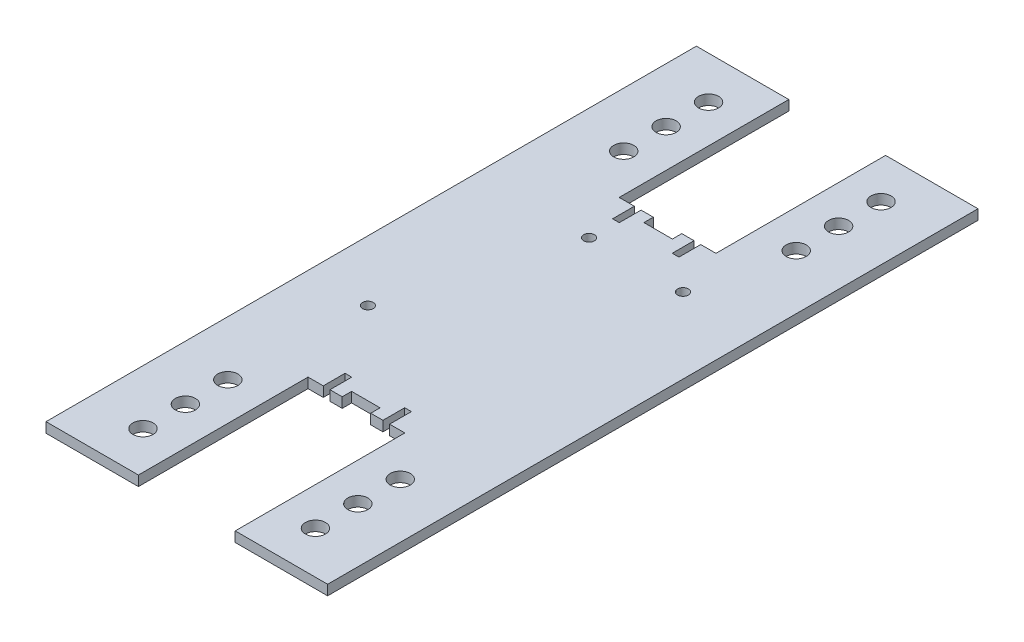
from build123d import *

# Parameters (mm, degrees)
ESBO_O1_W                = 84
ESBO_O1_H                = 3
RESSALTO_EXTRUS_O1_DEPTH = 194
CORTE_EXTRUS_O1_DEPTH    = 194
CORTE_EXTRUS_O5_DEPTH    = 10
CORTE_EXTRUS_O6_DEPTH    = 10
ESBO_O9_W                = 3.064404225
ESBO_O9_H                = 50.6
RESSALTO_EXTRUS_O2_DEPTH = 3
ESBO_O12_R               = 3
CORTE_EXTRUS_O8_DEPTH    = 3
ESBO_O14_R               = 3
RESSALTO_EXTRUS_O3_DEPTH = 3
ESBO_O16_R               = 3
CORTE_EXTRUS_O9_DEPTH    = 3
ESBO_O17_W               = 1
ESBO_O17_H               = 6.5
CORTE_EXTRUS_O10_DEPTH   = 10
ESBO_O18_W               = 2
ESBO_O18_H               = 6.5
CORTE_EXTRUS_O11_DEPTH   = 10
ESBO_O19_R               = 1.6
CORTE_EXTRUS_O12_DEPTH   = 10
CORTE_EXTRUS_O13_DEPTH   = 10
CORTE_EXTRUS_O14_DEPTH   = 10


with BuildPart() as part:
    # Esboço1 → Ressalto-extrusão1 (new body)
    with BuildSketch(Plane.XY):
        with Locations((-3.22930454, -1.5)):
            Rectangle(ESBO_O1_W, ESBO_O1_H)
    extrude(amount=RESSALTO_EXTRUS_O1_DEPTH)

    # Esboço2 → Corte-extrusão1 (cut)
    with BuildSketch(Plane(origin=(0, 0, 0), x_dir=(1, 0, 0), z_dir=(0, 1, 0))):
        Polygon((-3.22930454, 0), (9.27069546, 0), (9.27069546, -50.6), (-15.72930454, -50.6), (-15.72930454, 0), align=None)
        Polygon((-3.22930454, -194), (9.27069546, -194), (9.27069546, -143.4), (-15.72930454, -143.4), (-15.72930454, -194), align=None)
    extrude(amount=-CORTE_EXTRUS_O1_DEPTH, mode=Mode.SUBTRACT)

    # Esboço7 → Corte-extrusão5 (cut)
    with BuildSketch(Plane(origin=(0, 0, 0), x_dir=(1, 0, 0), z_dir=(0, 1, 0))):
        Polygon((-20.72930454, -50.6), (-3.22930454, -50.6), (14.27069546, -50.6), (14.27069546, 0), (-20.72930454, 0), align=None)
    extrude(amount=-CORTE_EXTRUS_O5_DEPTH, mode=Mode.SUBTRACT)

    # Esboço8 → Corte-extrusão6 (cut)
    with BuildSketch(Plane(origin=(0, 0, 0), x_dir=(1, 0, 0), z_dir=(0, 1, 0))):
        Polygon((14.27069546, -143.4), (-3.22930454, -143.4), (-20.72930454, -143.4), (-20.72930454, -194), (14.27069546, -194), align=None)
    extrude(amount=-CORTE_EXTRUS_O6_DEPTH, mode=Mode.SUBTRACT)

    # Esboço9 → Ressalto-extrusão2 (add)
    with BuildSketch(Plane(origin=(0, 0, 0), x_dir=(1, 0, 0), z_dir=(0, 1, 0))):
        with Locations((-19.197102427, -25.3)):
            Rectangle(ESBO_O9_W, ESBO_O9_H)
        with Locations((12.738493348, -25.3)):
            Rectangle(ESBO_O9_W, ESBO_O9_H)
    extrude(amount=-RESSALTO_EXTRUS_O2_DEPTH)

    # Esboço12 → Corte-extrusão8 (cut)
    with BuildSketch(Plane(origin=(0, 0, 0), x_dir=(1, 0, 0), z_dir=(0, 1, 0))):
        with Locations(Location((22.49182576, -37.95, 0), (0, 0, 270))):
            Circle(ESBO_O12_R)
        with Locations(Location((22.49182576, -25.3, 0), (0, 0, 270))):
            Circle(ESBO_O12_R)
        with Locations(Location((22.49182576, -12.65, 0), (0, 0, 270))):
            Circle(ESBO_O12_R)
        with Locations(Location((-28.94930454, -12.65, 0), (0, 0, 270))):
            Circle(ESBO_O12_R)
        with Locations(Location((-28.94930454, -25.3, 0), (0, 0, 270))):
            Circle(ESBO_O12_R)
        with Locations(Location((-28.94930454, -37.95, 0), (0, 0, 270))):
            Circle(ESBO_O12_R)
    extrude(amount=-CORTE_EXTRUS_O8_DEPTH, mode=Mode.SUBTRACT)

    # Esboço14 → Ressalto-extrusão3 (add)
    with BuildSketch(Plane(origin=(0, 0, 0), x_dir=(1, 0, 0), z_dir=(0, 1, 0))):
        Polygon((38.77069546, -194), (38.77069546, -97), (-45.22930454, -97), (-45.22930454, -194), (-17.664900315, -194), (-17.664900315, -143.4), (11.206291235, -143.4), (11.206291235, -194), align=None)
        with Locations((-28.94930454, -181.35)):
            Circle(ESBO_O14_R, mode=Mode.SUBTRACT)
        with Locations((-28.94930454, -168.7)):
            Circle(ESBO_O14_R, mode=Mode.SUBTRACT)
        with Locations((-28.94930454, -156.05)):
            Circle(ESBO_O14_R, mode=Mode.SUBTRACT)
        with Locations((22.49182576, -181.35)):
            Circle(ESBO_O14_R, mode=Mode.SUBTRACT)
        with Locations((22.49182576, -168.7)):
            Circle(ESBO_O14_R, mode=Mode.SUBTRACT)
        with Locations((22.49182576, -156.05)):
            Circle(ESBO_O14_R, mode=Mode.SUBTRACT)
    extrude(amount=-RESSALTO_EXTRUS_O3_DEPTH)

    # Esboço16 → Corte-extrusão9 (cut)
    with BuildSketch(Plane(origin=(0, 0, 0), x_dir=(1, 0, 0), z_dir=(0, 1, 0))):
        with Locations(Location((22.49182576, -37.95, 0), (0, 0, 270))):
            Circle(ESBO_O16_R)
        with Locations(Location((22.49182576, -25.3, 0), (0, 0, 270))):
            Circle(ESBO_O16_R)
        with Locations(Location((22.49182576, -12.65, 0), (0, 0, 270))):
            Circle(ESBO_O16_R)
        with Locations(Location((-28.94930454, -12.65, 0), (0, 0, 270))):
            Circle(ESBO_O16_R)
        with Locations(Location((-28.94930454, -25.3, 0), (0, 0, 270))):
            Circle(ESBO_O16_R)
        with Locations(Location((-28.94930454, -37.95, 0), (0, 0, 270))):
            Circle(ESBO_O16_R)
        with Locations(Location((-28.94930454, -156.05, 0), (0, 0, 90))):
            Circle(ESBO_O16_R)
        with Locations(Location((-28.94930454, -168.7, 0), (0, 0, 90))):
            Circle(ESBO_O16_R)
        with Locations(Location((-28.94930454, -181.35, 0), (0, 0, 90))):
            Circle(ESBO_O16_R)
        with Locations(Location((22.49182576, -181.35, 0), (0, 0, 90))):
            Circle(ESBO_O16_R)
        with Locations(Location((22.49182576, -168.7, 0), (0, 0, 90))):
            Circle(ESBO_O16_R)
        with Locations(Location((22.49182576, -156.05, 0), (0, 0, 90))):
            Circle(ESBO_O16_R)
    extrude(amount=-CORTE_EXTRUS_O9_DEPTH, mode=Mode.SUBTRACT)

    # Esboço17 → Corte-extrusão10 (cut)
    with BuildSketch(Plane(origin=(0, 0, 0), x_dir=(1, 0, 0), z_dir=(0, 1, 0))):
        with Locations((6.17069546, -53.85)):
            Rectangle(ESBO_O17_W, ESBO_O17_H)
        with Locations((5.17069546, -53.85)):
            Rectangle(ESBO_O17_W, ESBO_O17_H)
        Polygon((-11.12930454, -57.1), (-11.12930454, -50.6), (-12.12930454, -50.6), (-13.12930454, -50.6), (-13.12930454, -57.1), align=None)
    extrude(amount=-CORTE_EXTRUS_O10_DEPTH, mode=Mode.SUBTRACT)

    # Esboço18 → Corte-extrusão11 (cut)
    with BuildSketch(Plane(origin=(0, 0, 0), x_dir=(1, 0, 0), z_dir=(0, 1, 0))):
        with Locations((5.67069546, -140.15)):
            Rectangle(ESBO_O18_W, ESBO_O18_H)
        with Locations((-12.12930454, -140.15)):
            Rectangle(ESBO_O18_W, ESBO_O18_H)
    extrude(amount=-CORTE_EXTRUS_O11_DEPTH, mode=Mode.SUBTRACT)

    # Esboço19 → Corte-extrusão12 (cut)
    with BuildSketch(Plane(origin=(0, 0, 0), x_dir=(1, 0, 0), z_dir=(0, 1, 0))):
        with Locations(Location((-27.22930454, -116, 0), (0, 0, 270))):
            Circle(ESBO_O19_R)
        with Locations(Location((16.27069546, -65.5, 0), (0, 0, 270))):
            Circle(ESBO_O19_R)
        with Locations(Location((-11.72930454, -65.5, 0), (0, 0, 270))):
            Circle(ESBO_O19_R)
    extrude(amount=-CORTE_EXTRUS_O12_DEPTH, mode=Mode.SUBTRACT)

    # Esboço20 → Corte-extrusão13 (cut)
    with BuildSketch(Plane(origin=(0, 0, 0), x_dir=(1, 0, 0), z_dir=(0, 1, 0))):
        Polygon((-3.22930454, -140.6), (1.02069546, -140.6), (1.02069546, -143.4), (-7.47930454, -143.4), (-7.47930454, -140.6), align=None)
    extrude(amount=-CORTE_EXTRUS_O13_DEPTH, mode=Mode.SUBTRACT)

    # Esboço21 → Corte-extrusão14 (cut)
    with BuildSketch(Plane(origin=(0, 0, 0), x_dir=(1, 0, 0), z_dir=(0, 1, 0))):
        Polygon((-3.22930454, -53.4), (-7.47930454, -53.4), (-7.47930454, -50.6), (1.02069546, -50.6), (1.02069546, -53.4), align=None)
    extrude(amount=-CORTE_EXTRUS_O14_DEPTH, mode=Mode.SUBTRACT)


solid = part.part
